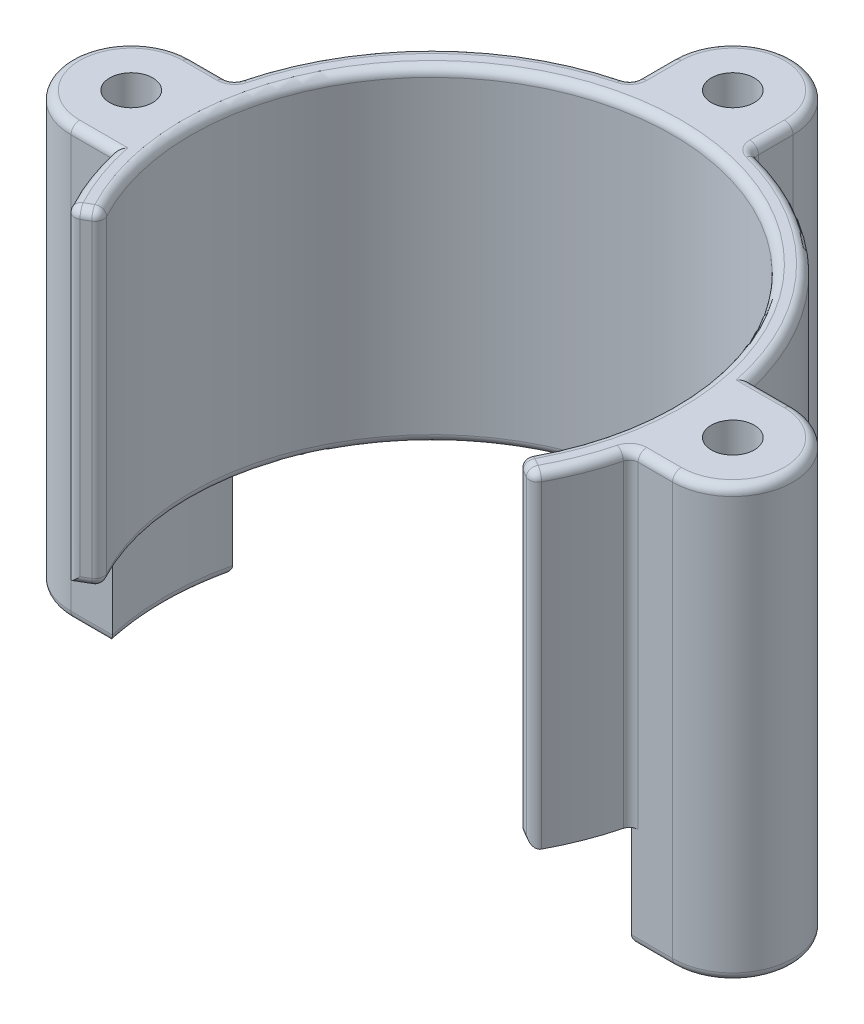
from build123d import *

# Parameters (mm, degrees)
SKETCH1_R       = 15.5
BODY_DEPTH      = 19
MOTORHOLE_DEPTH = 30.008619409
MOUNT_START     = -25
MOUNT_DEPTH     = 25
SKETCH8_R       = 1.25
MOUNTHOLE_DEPTH = 37.142080737
MOUNTS_COUNT    = 3
MOUNTS_ANGLE    = 180
FILLET4_R       = 0.5


with BuildPart() as part:
    # Sketch1 → Body (new body)
    with BuildSketch(Plane(origin=(0, 0, 0), x_dir=(1, 0, 0), z_dir=(0, 1, 0))):
        with Locations(Location((0, 0, 0), (0, 0, 270))):
            Circle(SKETCH1_R)
    extrude(amount=BODY_DEPTH)

    # Sketch5 → MotorHole (cut, through all)
    with BuildSketch(Plane(origin=(0, 19, 0), x_dir=(1, 0, 0), z_dir=(0, 1, 0))):
        with BuildLine():
            Line((-12.124355653, -7), (-13.423393759, -7.75))
            ThreePointArc((-13.423393759, -7.75), (0, -15.5), (13.423393759, -7.75))
            Line((13.423393759, -7.75), (12.124355653, -7))
            ThreePointArc((12.124355653, -7), (0, 14), (-12.124355653, -7))
        make_face()
    extrude(amount=-MOTORHOLE_DEPTH, mode=Mode.SUBTRACT)

    # Sketch2 → Mount (add)
    with BuildSketch(Plane(origin=(0, 19, 0), x_dir=(1, 0, 0), z_dir=(0, 1, 0)).offset(MOUNT_START)):
        with BuildLine():
            Line((-17.5, 3.5), (-15.099668871, 3.5))
            ThreePointArc((-15.099668871, 3.5), (-15.5, 0), (-15.099668871, -3.5))
            Line((-15.099668871, -3.5), (-17.5, -3.5))
            ThreePointArc((-17.5, -3.5), (-21, 0), (-17.5, 3.5))
        make_face()
    mount = extrude(amount=MOUNT_DEPTH)

    # Sketch8 → MountHole (cut, through all)
    with BuildSketch(Plane(origin=(0, 19, 0), x_dir=(1, 0, 0), z_dir=(0, 1, 0))):
        with Locations(Location((-17.5, 0, 0), (0, 0, 270))):
            Circle(SKETCH8_R)
    mounthole = extrude(amount=-MOUNTHOLE_DEPTH, mode=Mode.SUBTRACT)

    # MountS: Mount, MountHole ×3 about axis
    mounts_axis = Axis((0, 0, 0), (0, -1, 0))
    add([mount.rotate(mounts_axis, i * MOUNTS_ANGLE / (MOUNTS_COUNT - 1)) for i in range(1, MOUNTS_COUNT)])
    add([mounthole.rotate(mounts_axis, i * MOUNTS_ANGLE / (MOUNTS_COUNT - 1)) for i in range(1, MOUNTS_COUNT)], mode=Mode.SUBTRACT)

    # Fillet4
    fillet4_edges = [part.edges().sort_by_distance(p)[0] for p in [
        (12.773874706, 19, 7.375),
        (12.124355653, 9.5, 7),
        (13.423393759, 9.5, 7.75),
        (-12.773874706, 0, 7.375),
        (-13.423393759, 9.5, 7.75),
        (0, 0, -14),
        (-12.124355653, 9.5, 7),
        (12.773874706, 0, 7.375),
        (0, 19, -14),
        (-12.773874706, 19, 7.375),
        (-14.418977094, 19, 5.687099398),
        (-15.5, -6, 0),
        (-21, -6, 0),
        (-16.299834435, 19, -3.5),
        (-15.099668871, 9.5, -3.5),
        (-16.299834435, -6, 3.5),
        (-16.299834435, -6, -3.5),
        (-21, 19, 0),
        (-16.299834435, 19, 3.5),
        (14.418977094, 19, 5.687099398),
        (-10.960155108, 19, -10.960155108),
        (0, -6, -15.5),
        (0, -6, -21),
        (3.5, 19, -16.299834435),
        (3.5, 9.5, -15.099668871),
        (-3.5, -6, -16.299834435),
        (-3.5, 9.5, -15.099668871),
        (3.5, -6, -16.299834435),
        (0, 19, -21),
        (-3.5, 19, -16.299834435),
        (10.960155108, 19, -10.960155108),
        (15.5, -6, 0),
        (21, -6, 0),
        (16.299834435, 19, 3.5),
        (15.099668871, 9.5, 3.5),
        (16.299834435, -6, -3.5),
        (16.299834435, -6, 3.5),
        (21, 19, 0),
        (16.299834435, 19, -3.5),
    ]]
    fillet(fillet4_edges, radius=FILLET4_R)


solid = part.part
